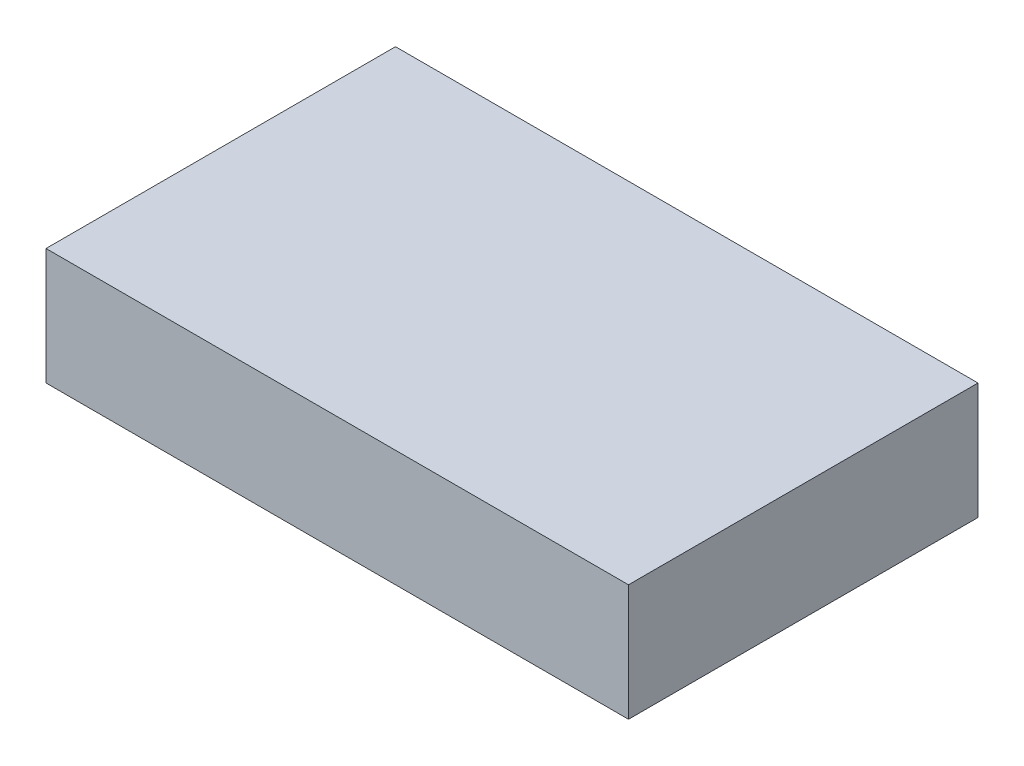
from build123d import *

# Parameters (mm, degrees)
SKETCH2_W           = 63.5
SKETCH2_H           = 38.1
BOSS_EXTRUDE1_DEPTH = 12.7


with BuildPart() as part:
    # Sketch2 → Boss-Extrude1 (new body)
    with BuildSketch(Plane(origin=(0, 0, 0), x_dir=(1, 0, 0), z_dir=(0, 1, 0))):
        with Locations((31.75, 19.05)):
            Rectangle(SKETCH2_W, SKETCH2_H)
    extrude(amount=BOSS_EXTRUDE1_DEPTH)


solid = part.part
